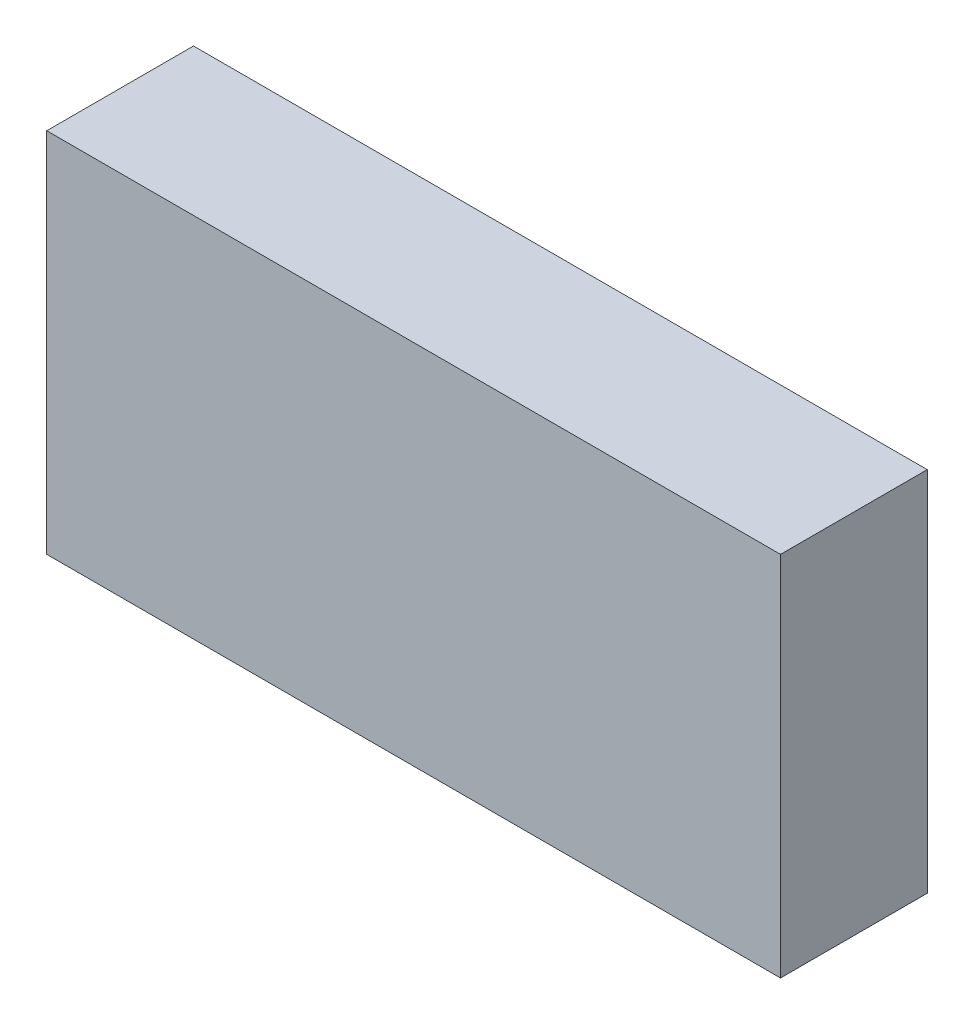
from build123d import *

# Parameters (mm, degrees)
SKETCH1_W           = 100
SKETCH1_H           = 50
BOSS_EXTRUDE1_DEPTH = 20
SHELL1_T            = 2


with BuildPart() as part:
    # Sketch1 → Boss-Extrude1 (new body)
    with BuildSketch(Plane.XY):
        with Locations((53, 30)):
            Rectangle(SKETCH1_W, SKETCH1_H)
    extrude(amount=BOSS_EXTRUDE1_DEPTH)

    # Shell1 (no face opened: a closed hollow body)
    add(offset(amount=-SHELL1_T, mode=Mode.PRIVATE), mode=Mode.SUBTRACT)


solid = part.part
